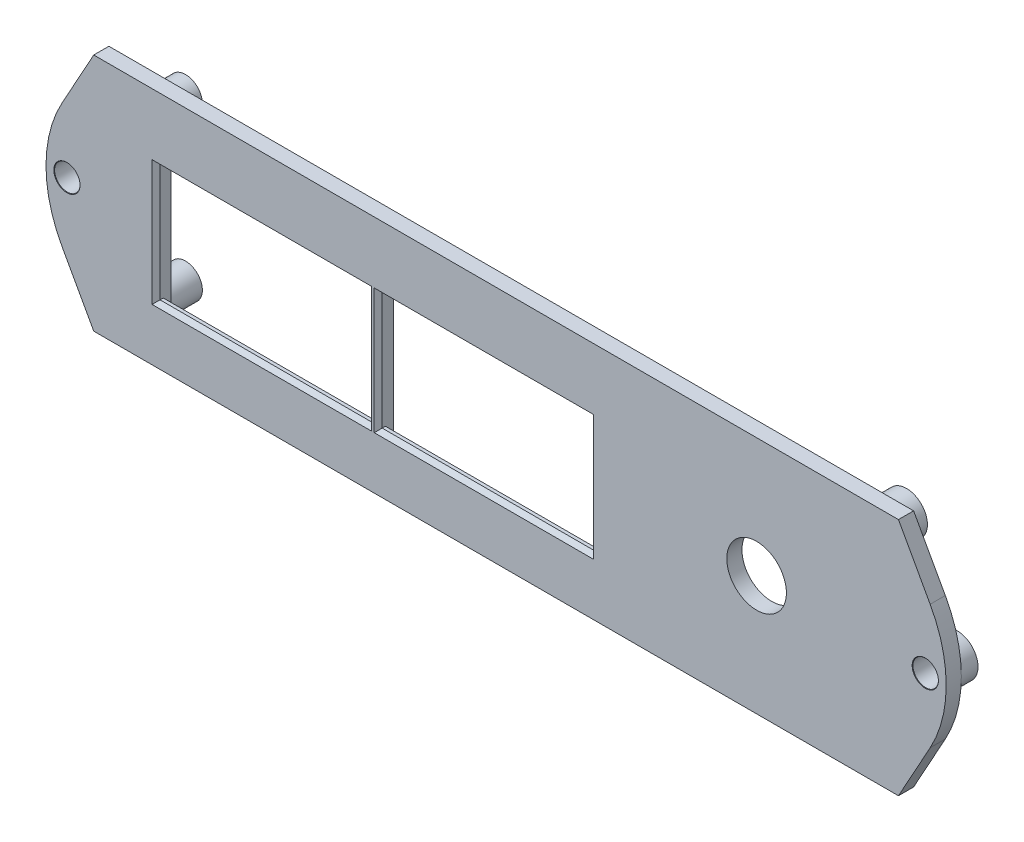
from build123d import *

# Parameters (mm, degrees)
BOSS_EXTRUDE1_DEPTH             = 1.905
SKETCH6_R                       = 2.629225159
BOSS_EXTRUDE4_DEPTH             = 2.095
F_3_0MM_DOWEL_HOLE1_D           = 3.2
F_3_0MM_DOWEL_HOLE1_CSINK_D     = 3.3
F_3_0MM_DOWEL_HOLE1_CSINK_ANGLE = 90
SKETCH7_R                       = 3.75
SKETCH7_W                       = 26.6
SKETCH7_H                       = 14.7701
CUT_EXTRUDE1_DEPTH              = 59.70468385
SKETCH9_R                       = 2.629225159
SKETCH9_R_2                     = 2.125
BOSS_EXTRUDE5_DEPTH             = 4.5
F_3_0MM_DOWEL_HOLE2_D           = 3.1
F_3_0MM_DOWEL_HOLE2_DEPTH       = 4
F_3_0MM_DOWEL_HOLE2_CSINK_D     = 3.3
F_3_0MM_DOWEL_HOLE2_CSINK_ANGLE = 90
F_3_0MM_DOWEL_HOLE2_TIP         = 0.931333959
SKETCH12_W                      = 26.6
SKETCH12_H                      = 25.3701
CUT_EXTRUDE2_DEPTH              = 1
CHAMFER1_SIZE                   = 0.5


with BuildPart() as part:
    # Sketch1 → Boss-Extrude1 (new body)
    with BuildSketch(Plane.XY):
        with BuildLine():
            Line((-50.6, 15.04), (50.6, 15.04))
            Line((50.6, 15.04), (54.590317598, 7.813493896))
            ThreePointArc((54.590317598, 7.813493896), (56.604225159, 0), (54.590317598, -7.813493896))
            Line((54.590317598, -7.813493896), (50.6, -15.04))
            Line((50.6, -15.04), (-50.6, -15.04))
            Line((-50.6, -15.04), (-54.590317598, -7.813493896))
            ThreePointArc((-54.590317598, -7.813493896), (-56.604225159, 0), (-54.590317598, 7.813493896))
            Line((-54.590317598, 7.813493896), (-50.6, 15.04))
        make_face()
    extrude(amount=BOSS_EXTRUDE1_DEPTH)

    # Sketch6 → Boss-Extrude4 (add)
    with BuildSketch(Plane(origin=(0, 0, 0), x_dir=(-1, 0, 0), z_dir=(0, 0, -1))):
        with Locations(Location((-53.975, 0, 0), (0, 0, 179.99945392))):
            Circle(SKETCH6_R)
        with Locations(Location((53.975, 0, 0), (0, 0, 359.99945398))):
            Circle(SKETCH6_R)
    extrude(amount=BOSS_EXTRUDE4_DEPTH)

    # Ø3.0mm Dowel Hole1 (through all)
    with Locations(Plane.XY.offset(1.905)):
        with Locations((53.975, 0), (-53.975, 0)):
            CounterSinkHole(F_3_0MM_DOWEL_HOLE1_D / 2, F_3_0MM_DOWEL_HOLE1_CSINK_D / 2, counter_sink_angle=F_3_0MM_DOWEL_HOLE1_CSINK_ANGLE)

    # Sketch7 → Cut-Extrude1 (cut, through all)
    with BuildSketch(Plane.XY.offset(1.905)):
        with Locations((32.762, 0)):
            Circle(SKETCH7_R)
        with Locations((-29.464, -0.57505)):
            Rectangle(SKETCH7_W, SKETCH7_H)
        with Locations((-1.524, -0.57505)):
            Rectangle(SKETCH7_W, SKETCH7_H)
    extrude(amount=-CUT_EXTRUDE1_DEPTH, mode=Mode.SUBTRACT)

    # Sketch9 → Boss-Extrude5 (add)
    with BuildSketch(Plane(origin=(0, 0, 0), x_dir=(-1, 0, 0), z_dir=(0, 0, -1))):
        with Locations((-45.212, 9.906)):
            Circle(SKETCH9_R)
        with Locations((-45.212, -10.16)):
            Circle(SKETCH9_R)
        with Locations((45.466, -10.16)):
            Circle(SKETCH9_R_2)
        with Locations((45.466, 10.16)):
            Circle(SKETCH9_R_2)
    extrude(amount=BOSS_EXTRUDE5_DEPTH)

    # Ø3.0mm Dowel Hole2
    with Locations(Plane(origin=(0, 0, -4.5), x_dir=(-1, 0, 0), z_dir=(0, 0, -1))):
        with Locations((-45.212, 9.906), (-45.212, -10.16), (45.466, -10.16), (45.466, 10.16)):
            CounterSinkHole(F_3_0MM_DOWEL_HOLE2_D / 2, F_3_0MM_DOWEL_HOLE2_CSINK_D / 2, depth=F_3_0MM_DOWEL_HOLE2_DEPTH, counter_sink_angle=F_3_0MM_DOWEL_HOLE2_CSINK_ANGLE)
            with Locations((0, 0, -(F_3_0MM_DOWEL_HOLE2_DEPTH + F_3_0MM_DOWEL_HOLE2_TIP / 2))):  # 118° drill point
                Cone(0, F_3_0MM_DOWEL_HOLE2_D / 2, F_3_0MM_DOWEL_HOLE2_TIP, mode=Mode.SUBTRACT)

    # Sketch12 → Cut-Extrude2 (cut)
    with BuildSketch(Plane(origin=(0, 0, 0), x_dir=(-1, 0, 0), z_dir=(0, 0, -1))):
        with Locations((1.524, -0.57505)):
            Rectangle(SKETCH12_W, SKETCH12_H)
        with Locations((29.464, -0.57505)):
            Rectangle(SKETCH12_W, SKETCH12_H)
    extrude(amount=-CUT_EXTRUDE2_DEPTH, mode=Mode.SUBTRACT)

    # Chamfer1
    chamfer1_edges = [part.edges().sort_by_distance(p)[0] for p in [
        (-42.764, -0.57505, 1.905),
        (-29.464, -7.9601, 1.905),
        (-16.164, -0.57505, 1.905),
        (-29.464, 6.81, 1.905),
        (-14.824, -0.57505, 1.905),
        (-1.524, -7.9601, 1.905),
        (11.776, -0.57505, 1.905),
        (-1.524, 6.81, 1.905),
    ]]
    chamfer(chamfer1_edges, length=CHAMFER1_SIZE)


solid = part.part
